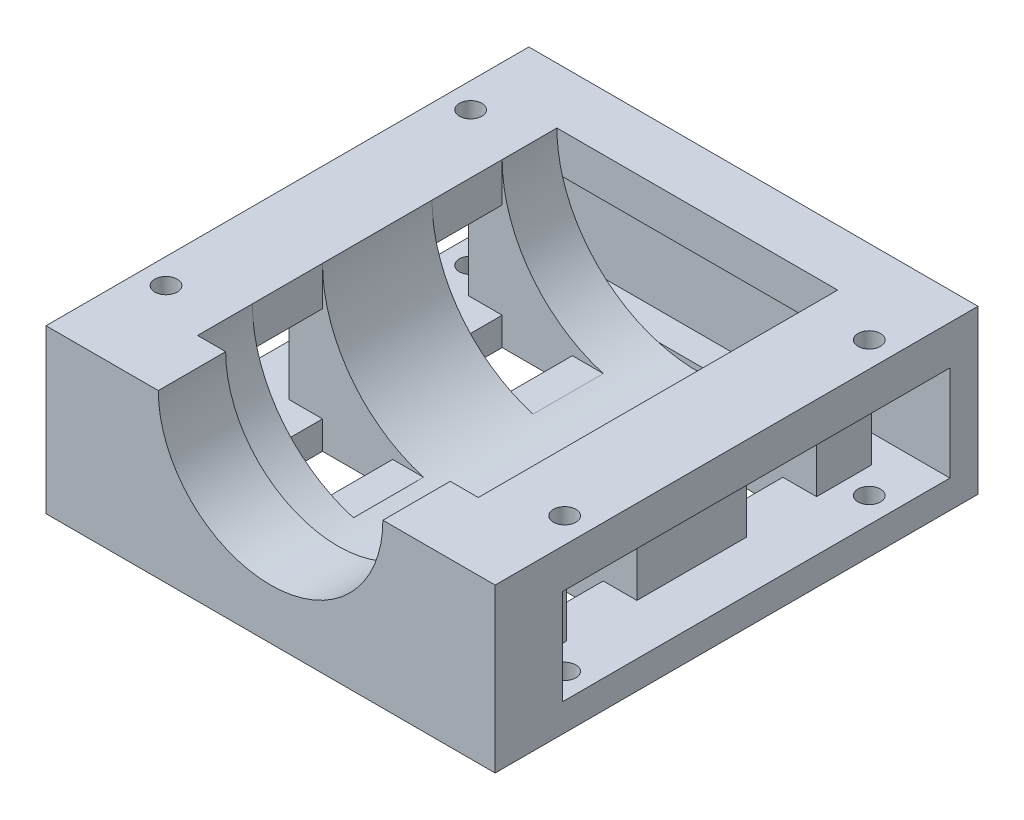
from build123d import *

# Parameters (mm, degrees)
BOSS_EXTRUDE1_DEPTH            = 64
BOSS_EXTRUDE2_DEPTH            = 12
SKETCH3_W                      = 12.5
SKETCH3_H                      = 12.5
CUT_EXTRUDE1_DEPTH             = 29
CUT_EXTRUDE2_REACH             = 106.125
SKETCH5_W                      = 12.5
SKETCH5_H                      = 17
CUT_EXTRUDE2_DIRECTION_2_REACH = 106.125
CUT_EXTRUDE3_REACH             = 116.092
SKETCH6_R                      = 2
SKETCH7_W                      = 80
SKETCH7_H                      = 29
BOSS_EXTRUDE3_DEPTH            = 10
SKETCH8_W                      = 5
SKETCH8_H                      = 17
CUT_EXTRUDE4_DEPTH             = 80


with BuildPart() as part:
    # Sketch1 → Boss-Extrude1 (new body)
    with BuildSketch(Plane.XY):
        with BuildLine():
            Line((0, 0), (80, 0))
            Line((80, 0), (80, 5))
            Line((80, 5), (71, 5))
            Line((71, 5), (71, 22))
            Line((71, 22), (80, 22))
            Line((80, 22), (80, 29))
            Line((80, 29), (65, 29))
            ThreePointArc((65, 29), (40, 4), (15, 29))
            Line((15, 29), (0, 29))
            Line((0, 29), (0, 22))
            Line((0, 22), (9, 22))
            Line((9, 22), (9, 5))
            Line((9, 5), (0, 5))
            Line((0, 5), (0, 0))
        make_face()
    extrude(amount=BOSS_EXTRUDE1_DEPTH)

    # Sketch2 → Boss-Extrude2 (add)
    with BuildSketch(Plane.XY.offset(64)):
        with BuildLine():
            Line((60, 29), (80, 29))
            Line((80, 29), (80, 0))
            Line((80, 0), (0, 0))
            Line((0, 0), (0, 29))
            Line((0, 29), (20, 29))
            ThreePointArc((20, 29), (40, 9), (60, 29))
        make_face()
    extrude(amount=BOSS_EXTRUDE2_DEPTH)

    # Sketch3 → Cut-Extrude1 (cut)
    with BuildSketch(Plane(origin=(0, 29, 0), x_dir=(1, 0, 0), z_dir=(0, 1, 0))):
        with Locations((21.25, -16)):
            Rectangle(SKETCH3_W, SKETCH3_H)
        with Locations((58.75, -16)):
            Rectangle(SKETCH3_W, SKETCH3_H)
        with Locations((21.25, -48)):
            Rectangle(SKETCH3_W, SKETCH3_H)
        with Locations((58.75, -48)):
            Rectangle(SKETCH3_W, SKETCH3_H)
    extrude(amount=-CUT_EXTRUDE1_DEPTH, mode=Mode.SUBTRACT)

    # Cut-Extrude2: up to this face of the body (flat: up to its plane)
    cut_extrude2_end = Plane(part.part.faces().sort_by_distance((9, 13.5, 32))[0])
    # Sketch5 → Cut-Extrude2 (cut, up to the picked face)
    with BuildSketch(Plane(origin=(15, 0, 0), x_dir=(0, 0, -1), z_dir=(1, 0, 0)), mode=Mode.PRIVATE) as cut_extrude2_sk1:
        with Locations((-48, 13.5)):
            Rectangle(SKETCH5_W, SKETCH5_H)
    cut_extrude2_tool1 = split(extrude(cut_extrude2_sk1.sketch, amount=-CUT_EXTRUDE2_REACH, mode=Mode.PRIVATE), bisect_by=cut_extrude2_end, keep=Keep.BOTH, mode=Mode.PRIVATE)
    # Sketch5 → Cut-Extrude2 (cut, up to the picked face)
    with BuildSketch(Plane(origin=(15, 0, 0), x_dir=(0, 0, -1), z_dir=(1, 0, 0)), mode=Mode.PRIVATE) as cut_extrude2_sk2:
        with Locations((-16, 13.5)):
            Rectangle(SKETCH5_W, SKETCH5_H)
    cut_extrude2_tool2 = split(extrude(cut_extrude2_sk2.sketch, amount=-CUT_EXTRUDE2_REACH, mode=Mode.PRIVATE), bisect_by=cut_extrude2_end, keep=Keep.BOTH, mode=Mode.PRIVATE)
    add(cut_extrude2_tool1.solids().sort_by(Axis((15, 13.5, 48), (-1, 0, 0)))[0], mode=Mode.SUBTRACT)
    add(cut_extrude2_tool2.solids().sort_by(Axis((15, 13.5, 16), (-1, 0, 0)))[0], mode=Mode.SUBTRACT)

    # Cut-Extrude2 direction 2: up to this face of the body (flat: up to its plane)
    cut_extrude2_direction_2_end = Plane(part.part.faces().sort_by_distance((71, 13.5, 32))[0])
    # Sketch5 → Cut-Extrude2 direction 2 (cut, up to the picked face)
    with BuildSketch(Plane(origin=(15, 0, 0), x_dir=(0, 0, -1), z_dir=(1, 0, 0)), mode=Mode.PRIVATE) as cut_extrude2_direction_2_sk1:
        with Locations((-48, 13.5)):
            Rectangle(SKETCH5_W, SKETCH5_H)
    cut_extrude2_direction_2_tool1 = split(extrude(cut_extrude2_direction_2_sk1.sketch, amount=CUT_EXTRUDE2_DIRECTION_2_REACH, mode=Mode.PRIVATE), bisect_by=cut_extrude2_direction_2_end, keep=Keep.BOTH, mode=Mode.PRIVATE)
    # Sketch5 → Cut-Extrude2 direction 2 (cut, up to the picked face)
    with BuildSketch(Plane(origin=(15, 0, 0), x_dir=(0, 0, -1), z_dir=(1, 0, 0)), mode=Mode.PRIVATE) as cut_extrude2_direction_2_sk2:
        with Locations((-16, 13.5)):
            Rectangle(SKETCH5_W, SKETCH5_H)
    cut_extrude2_direction_2_tool2 = split(extrude(cut_extrude2_direction_2_sk2.sketch, amount=CUT_EXTRUDE2_DIRECTION_2_REACH, mode=Mode.PRIVATE), bisect_by=cut_extrude2_direction_2_end, keep=Keep.BOTH, mode=Mode.PRIVATE)
    add(cut_extrude2_direction_2_tool1.solids().sort_by(Axis((15, 13.5, 48), (1, 0, 0)))[0], mode=Mode.SUBTRACT)
    add(cut_extrude2_direction_2_tool2.solids().sort_by(Axis((15, 13.5, 16), (1, 0, 0)))[0], mode=Mode.SUBTRACT)

    # Cut-Extrude3: up to this face of the body (flat: up to its plane)
    cut_extrude3_end = Plane(part.part.faces().sort_by_distance((72, 29, 39.6))[0])
    # Sketch6 → Cut-Extrude3 (cut, up to the picked face)
    with BuildSketch(Plane(origin=(0, 0, 0), x_dir=(-1, 0, 0), z_dir=(0, -1, 0)), mode=Mode.PRIVATE) as cut_extrude3_sk1:
        with Locations(Location((-4.499910861, -59.125, 0), (0, 0, 90))):
            Circle(SKETCH6_R)
    cut_extrude3_tool1 = split(extrude(cut_extrude3_sk1.sketch, amount=-CUT_EXTRUDE3_REACH, mode=Mode.PRIVATE), bisect_by=cut_extrude3_end, keep=Keep.BOTH, mode=Mode.PRIVATE)
    # Sketch6 → Cut-Extrude3 (cut, up to the picked face)
    with BuildSketch(Plane(origin=(0, 0, 0), x_dir=(-1, 0, 0), z_dir=(0, -1, 0)), mode=Mode.PRIVATE) as cut_extrude3_sk2:
        with Locations(Location((-4.499910861, -4.875, 0), (0, 0, 180))):
            Circle(SKETCH6_R)
    cut_extrude3_tool2 = split(extrude(cut_extrude3_sk2.sketch, amount=-CUT_EXTRUDE3_REACH, mode=Mode.PRIVATE), bisect_by=cut_extrude3_end, keep=Keep.BOTH, mode=Mode.PRIVATE)
    # Sketch6 → Cut-Extrude3 (cut, up to the picked face)
    with BuildSketch(Plane(origin=(0, 0, 0), x_dir=(-1, 0, 0), z_dir=(0, -1, 0)), mode=Mode.PRIVATE) as cut_extrude3_sk3:
        with Locations(Location((-75.500089139, -4.875, 0), (0, 0, 180))):
            Circle(SKETCH6_R)
    cut_extrude3_tool3 = split(extrude(cut_extrude3_sk3.sketch, amount=-CUT_EXTRUDE3_REACH, mode=Mode.PRIVATE), bisect_by=cut_extrude3_end, keep=Keep.BOTH, mode=Mode.PRIVATE)
    # Sketch6 → Cut-Extrude3 (cut, up to the picked face)
    with BuildSketch(Plane(origin=(0, 0, 0), x_dir=(-1, 0, 0), z_dir=(0, -1, 0)), mode=Mode.PRIVATE) as cut_extrude3_sk4:
        with Locations(Location((-75.500089139, -59.125, 0), (0, 0, 180))):
            Circle(SKETCH6_R)
    cut_extrude3_tool4 = split(extrude(cut_extrude3_sk4.sketch, amount=-CUT_EXTRUDE3_REACH, mode=Mode.PRIVATE), bisect_by=cut_extrude3_end, keep=Keep.BOTH, mode=Mode.PRIVATE)
    add(cut_extrude3_tool1.solids().sort_by(Axis((4.499911, 0, 59.125), (0, 1, 0)))[0], mode=Mode.SUBTRACT)
    add(cut_extrude3_tool2.solids().sort_by(Axis((4.499911, 0, 4.875), (0, 1, 0)))[0], mode=Mode.SUBTRACT)
    add(cut_extrude3_tool3.solids().sort_by(Axis((75.500089, 0, 4.875), (0, 1, 0)))[0], mode=Mode.SUBTRACT)
    add(cut_extrude3_tool4.solids().sort_by(Axis((75.500089, 0, 59.125), (0, 1, 0)))[0], mode=Mode.SUBTRACT)

    # Sketch7 → Boss-Extrude3 (add)
    with BuildSketch(Plane(origin=(0, 0, 0), x_dir=(-1, 0, 0), z_dir=(0, 0, -1))):
        with Locations((-40, 14.5)):
            Rectangle(SKETCH7_W, SKETCH7_H)
    extrude(amount=BOSS_EXTRUDE3_DEPTH)

    # Sketch8 → Cut-Extrude4 (cut)
    with BuildSketch(Plane(origin=(80, 0, 0), x_dir=(0, 0, -1), z_dir=(1, 0, 0))):
        with Locations((2.5, 13.5)):
            Rectangle(SKETCH8_W, SKETCH8_H)
    extrude(amount=-CUT_EXTRUDE4_DEPTH, mode=Mode.SUBTRACT)


solid = part.part
